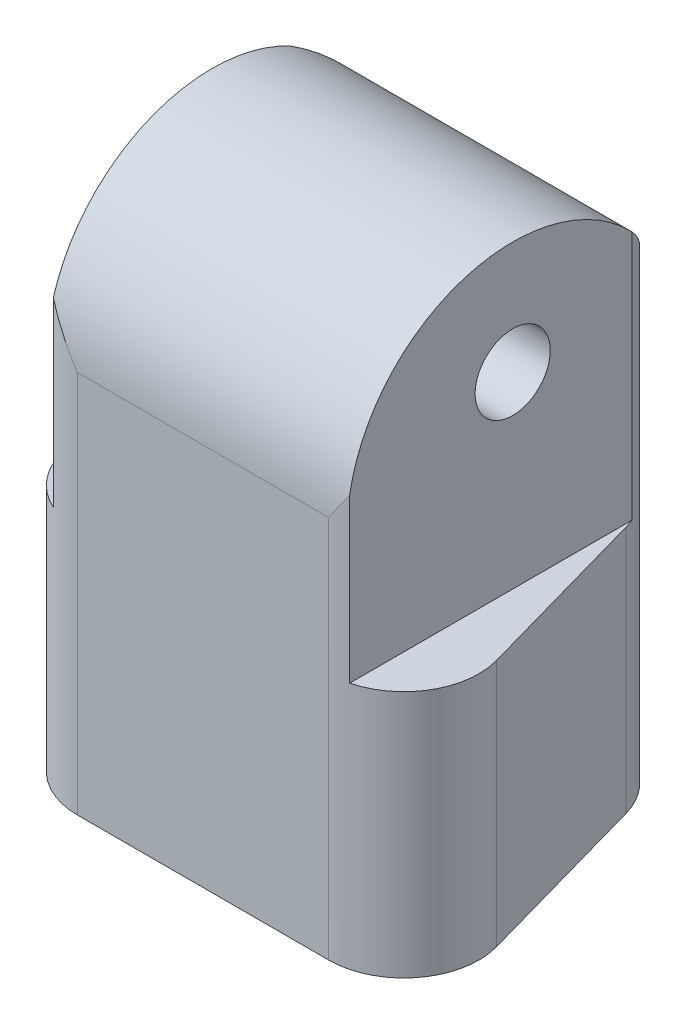
from build123d import *

# Parameters (mm, degrees)
BOSS_EXTRUDE1_DEPTH     = 15.5
BOSS_EXTRUDE2_DEPTH     = 21
CUT_EXTRUDE1_DEPTH      = 41.394764856
CUT_EXTRUDE1_DEPTH_BACK = 41.394764856
SKETCH5_W               = 5
SKETCH5_H               = 20
CUT_EXTRUDE2_DEPTH      = 45.501766026
SKETCH7_R               = 2.5
CUT_EXTRUDE3_DEPTH      = 45.501766184


with BuildPart() as part:
    # Sketch1 → Boss-Extrude1 (new body)
    with BuildSketch(Plane(origin=(0, 0, 0), x_dir=(1, 0, 0), z_dir=(0, 1, 0))):
        with BuildLine():
            Line((-8.359903733, -11), (8.359903733, -11))
            ThreePointArc((8.359903733, -11), (12.345417465, -9.01921849), (13.173158433, -4.646272115))
            Line((13.173158433, -4.646272115), (9.798158433, 7.353727885))
            ThreePointArc((9.798158433, 7.353727885), (8.004122222, 9.985513732), (4.984903733, 11))
            Line((4.984903733, 11), (-4.984903733, 11))
            ThreePointArc((-4.984903733, 11), (-8.004122222, 9.985513732), (-9.798158433, 7.353727885))
            Line((-9.798158433, 7.353727885), (-13.173158433, -4.646272115))
            ThreePointArc((-13.173158433, -4.646272115), (-12.345417465, -9.01921849), (-8.359903733, -11))
        make_face()
        with BuildLine():
            Line((-8.359903733, -8), (8.359903733, -8))
            ThreePointArc((8.359903733, -8), (9.954109226, -7.207687396), (10.285205613, -5.458508846))
            Line((10.285205613, -5.458508846), (6.910205613, 6.541491154))
            ThreePointArc((6.910205613, 6.541491154), (6.192591129, 7.594205493), (4.984903733, 8))
            Line((4.984903733, 8), (-4.984903733, 8))
            ThreePointArc((-4.984903733, 8), (-6.192591129, 7.594205493), (-6.910205613, 6.541491154))
            Line((-6.910205613, 6.541491154), (-10.285205613, -5.458508846))
            ThreePointArc((-10.285205613, -5.458508846), (-9.954109226, -7.207687396), (-8.359903733, -8))
        make_face(mode=Mode.SUBTRACT)
    extrude(amount=BOSS_EXTRUDE1_DEPTH)

    # Sketch2 → Boss-Extrude2 (add)
    with BuildSketch(Plane(origin=(0, 15.5, 0), x_dir=(1, 0, 0), z_dir=(0, 1, 0))):
        with BuildLine():
            Line((-8.359903733, -11), (8.359903733, -11))
            ThreePointArc((8.359903733, -11), (12.345417465, -9.01921849), (13.173158433, -4.646272115))
            Line((13.173158433, -4.646272115), (9.798158433, 7.353727885))
            ThreePointArc((9.798158433, 7.353727885), (8.004122222, 9.985513732), (4.984903733, 11))
            Line((4.984903733, 11), (-4.984903733, 11))
            ThreePointArc((-4.984903733, 11), (-8.004122222, 9.985513732), (-9.798158433, 7.353727885))
            Line((-9.798158433, 7.353727885), (-13.173158433, -4.646272115))
            ThreePointArc((-13.173158433, -4.646272115), (-12.345417465, -9.01921849), (-8.359903733, -11))
        make_face()
    extrude(amount=BOSS_EXTRUDE2_DEPTH)

    # Sketch5 → Cut-Extrude1 (cut, two sides: drawn at the far end of the back side and taken through both)
    with BuildSketch(Plane.XY.offset(-CUT_EXTRUDE1_DEPTH_BACK)):
        with Locations((-12.9, 26.5)):
            Rectangle(SKETCH5_W, SKETCH5_H)
        with Locations((12.1, 26.5)):
            Rectangle(SKETCH5_W, SKETCH5_H)
    extrude(amount=CUT_EXTRUDE1_DEPTH + CUT_EXTRUDE1_DEPTH_BACK, mode=Mode.SUBTRACT)

    # Sketch6 → Cut-Extrude2 (cut, through all)
    with BuildSketch(Plane(origin=(9.6, 0, 0), x_dir=(0, 0, -1), z_dir=(1, 0, 0))):
        with BuildLine():
            Line((-11, 25.5), (-13.511925643, 25.5))
            Line((-13.511925643, 25.5), (-13.511925643, 39.47554789))
            Line((-13.511925643, 39.47554789), (12.597570911, 39.037258979))
            Line((12.597570911, 39.037258979), (12.597570911, 25.5))
            Line((12.597570911, 25.5), (11, 25.5))
            ThreePointArc((11, 25.5), (0, 36.5), (-11, 25.5))
        make_face()
    extrude(amount=-CUT_EXTRUDE2_DEPTH, mode=Mode.SUBTRACT)

    # Sketch7 → Cut-Extrude3 (cut, through all)
    with BuildSketch(Plane(origin=(9.6, 0, 0), x_dir=(0, 0, -1), z_dir=(1, 0, 0))):
        with Locations(Location((0, 29, 0), (0, 0, 90))):
            Circle(SKETCH7_R)
    extrude(amount=-CUT_EXTRUDE3_DEPTH, mode=Mode.SUBTRACT)


solid = part.part
